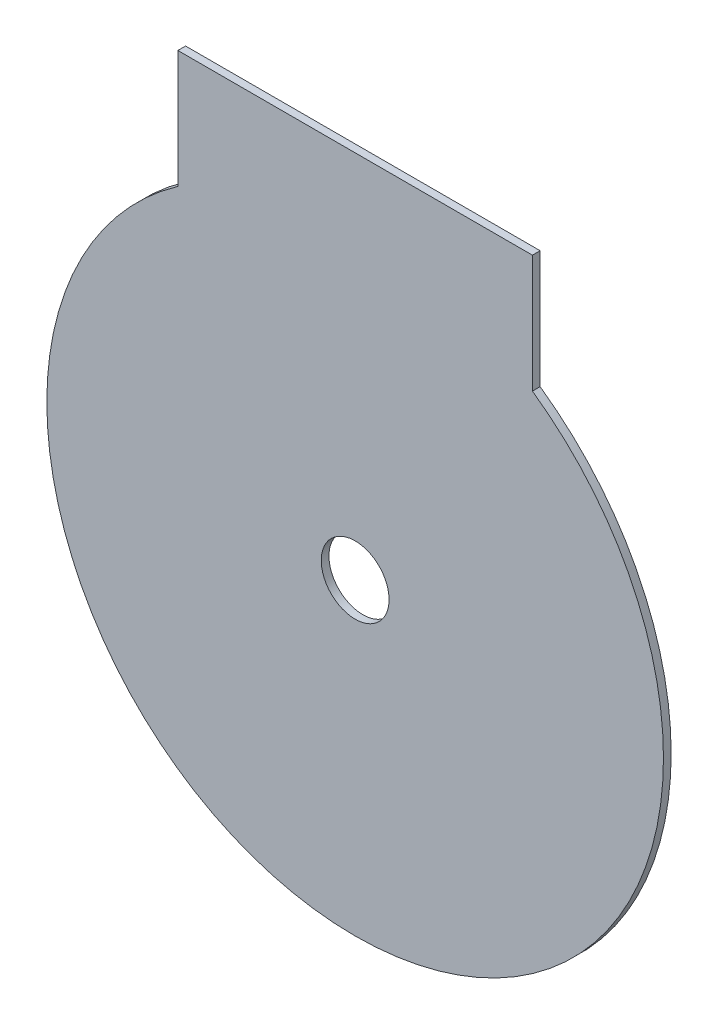
from build123d import *

# Parameters (mm, degrees)
SKETCH2_R           = 11
BOSS_EXTRUDE1_DEPTH = 2.5


with BuildPart() as part:
    # Sketch2 → Boss-Extrude1 (new body)
    with BuildSketch(Plane.XY):
        with BuildLine():
            Line((-57.5, 249), (-57.5, 210.81534086))
            ThreePointArc((-57.5, 210.81534086), (0, 29), (57.5, 210.81534086))
            Line((57.5, 210.81534086), (57.5, 249))
            Line((57.5, 249), (-57.5, 249))
        make_face()
        with Locations((0, 129)):
            Circle(SKETCH2_R, mode=Mode.SUBTRACT)
    extrude(amount=BOSS_EXTRUDE1_DEPTH)


solid = part.part
